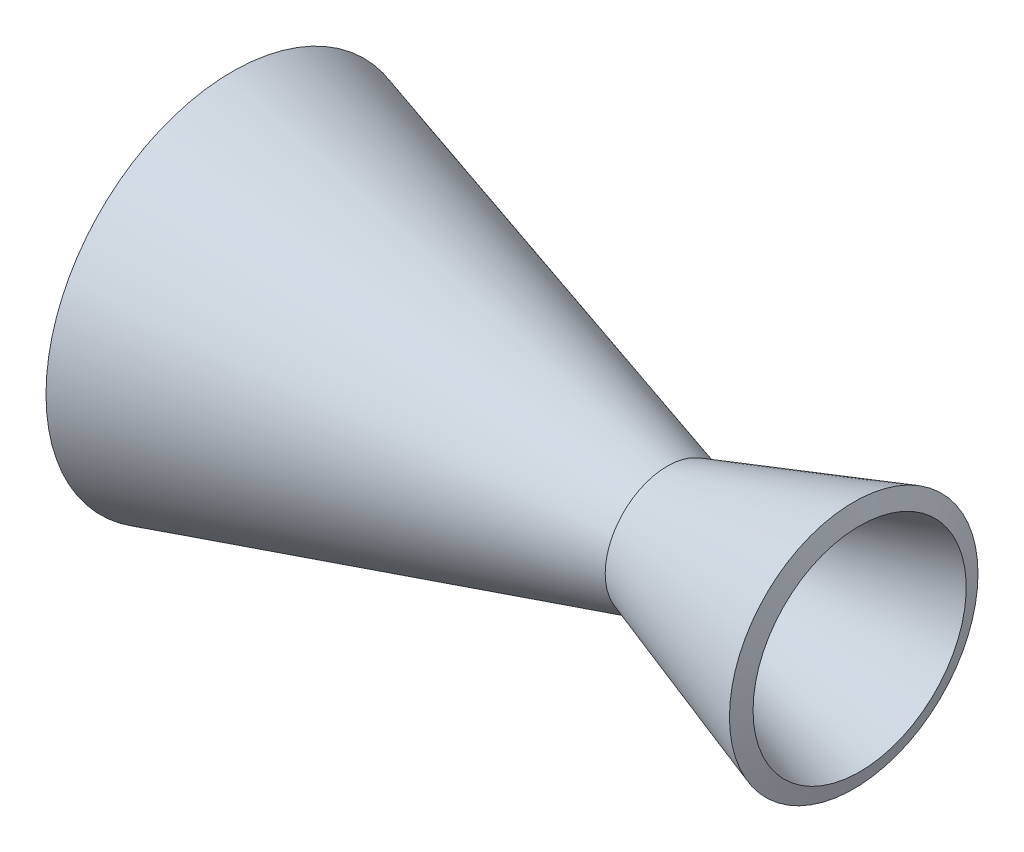
from build123d import *


with BuildPart() as part:
    # Sketch1 → Revolve-Thin1 (revolve)
    with BuildSketch(Plane.XY, mode=Mode.PRIVATE) as revolve_thin1_sk:
        Polygon((0, 30), (70, 10), (100, 20), (100.948683298, 17.153950106), (70.068218605, 6.860461875), (-0.824163384, 27.115428157), align=None)
    revolve(revolve_thin1_sk.sketch.rotate(Axis((0, 0, 0), (1, 0, 0)), 90), axis=Axis((0, 0, 0), (1, 0, 0)))


solid = part.part
